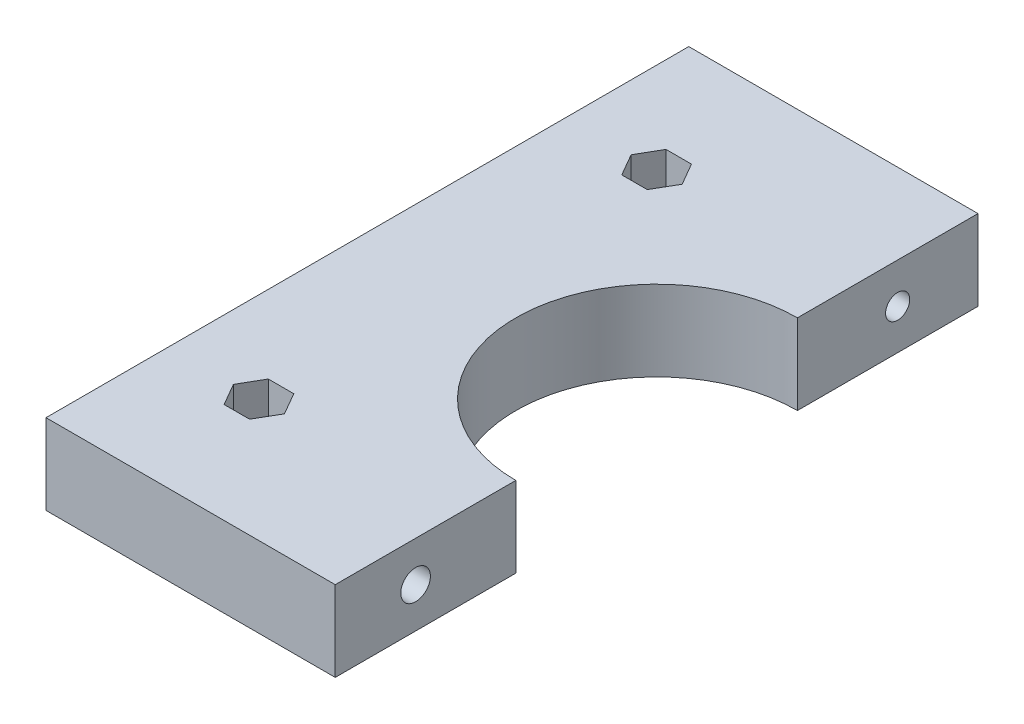
from build123d import *

# Parameters (mm, degrees)
BOSS_EXTRUDE1_DEPTH      = 5
BOSS_EXTRUDE1_DEPTH_BACK = 5
SKETCH1_R                = 1.5
CUT_EXTRUDE1_DEPTH       = 5
SKETCH5_R                = 2.5
CUT_EXTRUDE3_DEPTH       = 30
SKETCH6_R                = 1.5
SKETCH6_R_2              = 1.843261337
CUT_EXTRUDE4_DEPTH       = 42


with BuildPart() as part:
    # Sketch1 → Boss-Extrude1 (new, two sides: drawn at the far end of the back side and taken through both)
    with BuildSketch(Plane(origin=(0, 0, 0), x_dir=(1, 0, 0), z_dir=(0, 1, 0)).offset(-BOSS_EXTRUDE1_DEPTH_BACK)):
        with BuildLine():
            Line((0, 17.525), (0, 40))
            Line((0, 40), (-36, 40))
            Line((-36, 40), (-36, -40))
            Line((-36, -40), (0, -40))
            Line((0, -40), (0, -17.525))
            ThreePointArc((0, -17.525), (-17.525, 0), (0, 17.525))
        make_face()
        with Locations((-24.748737342, 24.748737342)):
            Circle(SKETCH1_R, mode=Mode.SUBTRACT)
        with Locations((-24.748737342, -24.748737342)):
            Circle(SKETCH1_R, mode=Mode.SUBTRACT)
    extrude(amount=BOSS_EXTRUDE1_DEPTH + BOSS_EXTRUDE1_DEPTH_BACK)

    # Sketch2 → Cut-Extrude1 (cut)
    with BuildSketch(Plane(origin=(0, 5, 0), x_dir=(1, 0, 0), z_dir=(0, 1, 0))):
        Polygon((-23.161024101, 27.498737342), (-26.336450582, 27.498737342), (-27.924163822, 24.748737342), (-26.336450582, 21.998737342), (-23.161024101, 21.998737342), (-21.573310861, 24.748737342), align=None)
    cut_extrude1 = extrude(amount=-CUT_EXTRUDE1_DEPTH, mode=Mode.SUBTRACT)

    # Mirror1: Cut-Extrude1 across plane
    add(cut_extrude1.mirror(Plane.XY), mode=Mode.SUBTRACT)

    # Sketch5 → Cut-Extrude3 (cut)
    with BuildSketch(Plane.ZY.offset(36)):
        with Locations((-30, 0)):
            Circle(SKETCH5_R)
        Polygon((31.592573026, 2.747490689), (28.417151509, 2.753105152), (26.824578483, 0.005916682), (28.407426974, -2.746886251), (31.582848491, -2.752500714), (33.175421517, -0.005312244), align=None)
    extrude(amount=-CUT_EXTRUDE3_DEPTH, mode=Mode.SUBTRACT)

    # Sketch6 → Cut-Extrude4 (cut)
    with BuildSketch(Plane.ZY.offset(36)):
        with Locations((-30, 0)):
            Circle(SKETCH6_R)
        with Locations((30, 0)):
            Circle(SKETCH6_R_2)
    extrude(amount=-CUT_EXTRUDE4_DEPTH, mode=Mode.SUBTRACT)


solid = part.part
